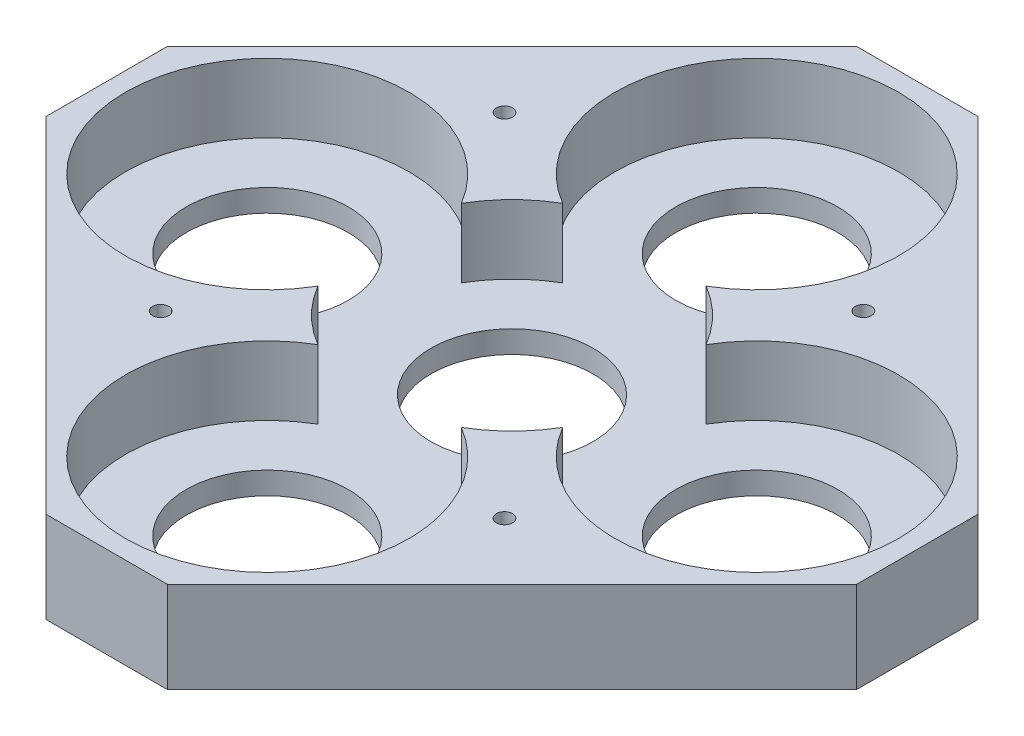
from build123d import *

# Parameters (mm, degrees)
BOSS_EXTRUDE1_DEPTH        = 28.575
CUT_EXTRUDE1_DEPTH         = 21.59
F_8_0_199_DIAMETER_HOLE1_D = 5.0546
HOLE1_D                    = 50.8
CHAMFER1_SIZE              = 26.940768363


with BuildPart() as part:
    # Sketch1 → Boss-Extrude1 (new body)
    with BuildSketch(Plane(origin=(0, 28.575, 0), x_dir=(1, 0, 0), z_dir=(0, 1, 0))):
        Polygon((127, 273.05), (-19.05, 127), (127, -19.05), (273.05, 127), align=None)
    extrude(amount=-BOSS_EXTRUDE1_DEPTH)

    # Sketch2 → Cut-Extrude1 (cut)
    with BuildSketch(Plane(origin=(0, 28.575, 0), x_dir=(-1, 0, 0), z_dir=(0, 1, 0))):
        with BuildLine():
            ThreePointArc((-149.467157898, -88.646), (-158.430896424, -95.569103576), (-165.354, -104.532842102))
            ThreePointArc((-165.354, -104.532842102), (-248.158, -127), (-165.354, -149.467157898))
            ThreePointArc((-165.354, -149.467157898), (-158.430896424, -158.430896424), (-149.467157898, -165.354))
            ThreePointArc((-149.467157898, -165.354), (-127, -248.158), (-104.532842102, -165.354))
            ThreePointArc((-104.532842102, -165.354), (-95.569103576, -158.430896424), (-88.646, -149.467157898))
            ThreePointArc((-88.646, -149.467157898), (-5.842, -127), (-88.646, -104.532842102))
            ThreePointArc((-88.646, -104.532842102), (-95.569103576, -95.569103576), (-104.532842102, -88.646))
            ThreePointArc((-104.532842102, -88.646), (-127, -5.842), (-149.467157898, -88.646))
        make_face()
    extrude(amount=-CUT_EXTRUDE1_DEPTH, mode=Mode.SUBTRACT)

    # #8 (0.199) Diameter Hole1 (through all)
    with Locations(Plane(origin=(0, 28.575, 0), x_dir=(1, 0, 0), z_dir=(0, 1, 0))):
        with Locations((180.881536726, 183.247438789), (180.881536726, 70.752561211), (70.752561211, 73.118463274), (70.752561211, 180.881536726)):
            Hole(F_8_0_199_DIAMETER_HOLE1_D / 2)

    # Hole1 (through all)
    with Locations(Plane(origin=(0, 6.985, 0), x_dir=(1, 0, 0), z_dir=(0, 1, 0))):
        with Locations((127, 127), (127, 203.708), (50.292, 127), (127, 50.292), (203.708, 127)):
            Hole(HOLE1_D / 2)

    # Chamfer1
    chamfer1_edges = [part.edges().sort_by_distance(p)[0] for p in [
        (273.05, 14.2875, -127),
        (127, 14.2875, 19.05),
        (-19.05, 14.2875, -127),
        (127, 14.2875, -273.05),
    ]]
    chamfer(chamfer1_edges, length=CHAMFER1_SIZE)


solid = part.part
